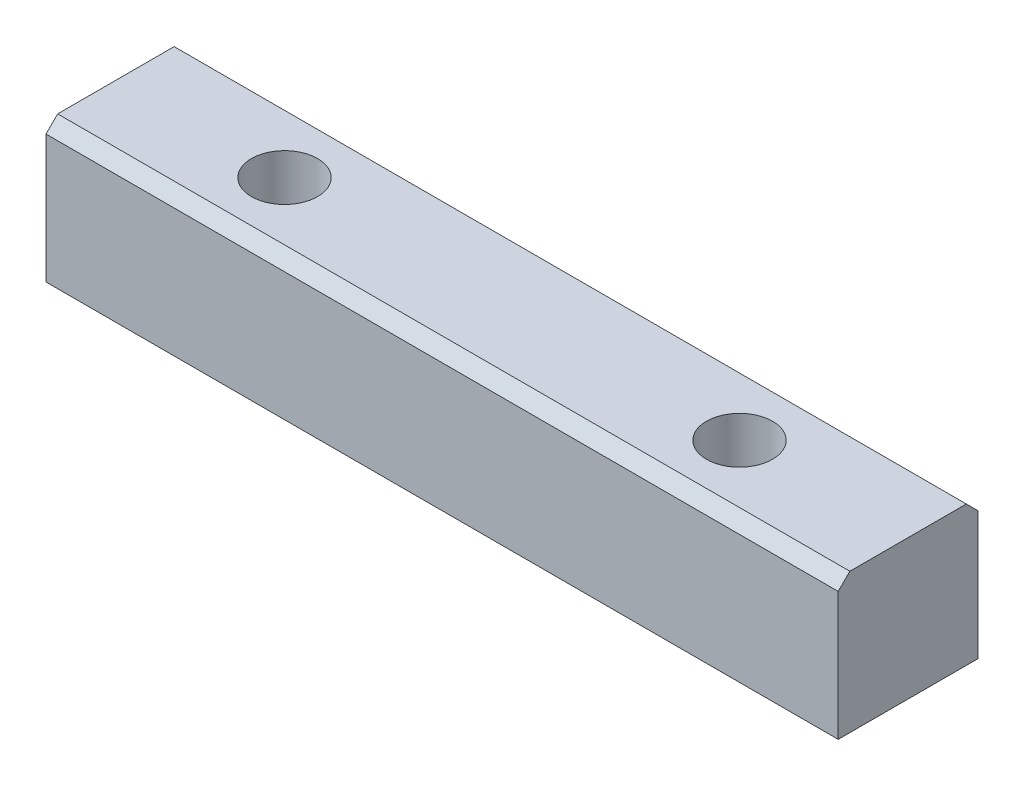
from build123d import *

# Parameters (mm, degrees)
SKETCH1_W            = 19.05
SKETCH1_H            = 19.05
BOSS_EXTRUDE1_DEPTH  = 53.975
M8_CLEARANCE_HOLE1_D = 9
CHAMFER1_SIZE        = 1.5875


with BuildPart() as part:
    # Sketch1 → Boss-Extrude1 (new, symmetric)
    with BuildSketch(Plane(origin=(0, 0, 0), x_dir=(0, 0, -1), z_dir=(1, 0, 0))):
        Rectangle(SKETCH1_W, SKETCH1_H)
    extrude(amount=BOSS_EXTRUDE1_DEPTH, both=True)

    # M8 Clearance Hole1 (through all)
    with Locations(Plane(origin=(0, 9.525, 0), x_dir=(1, 0, 0), z_dir=(0, 1, 0))):
        with Locations((-31, 0), (31, 0)):
            Hole(M8_CLEARANCE_HOLE1_D / 2)

    # Chamfer1
    chamfer1_edges = [part.edges().sort_by_distance(p)[0] for p in [
        (0, 9.525, 9.525),
        (0, 9.525, -9.525),
    ]]
    chamfer(chamfer1_edges, length=CHAMFER1_SIZE)


solid = part.part
